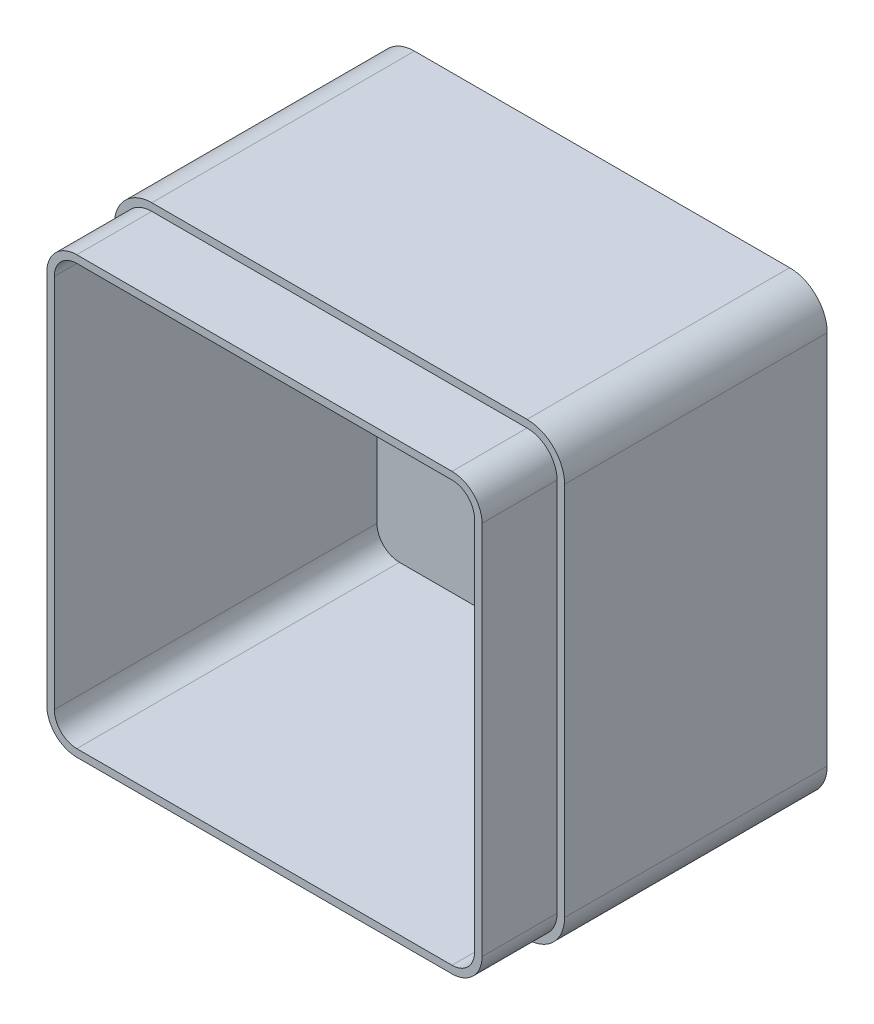
from build123d import *

# Parameters (mm, degrees)
SKETCH1_W           = 120
SKETCH1_H           = 120
BOSS_EXTRUDE1_DEPTH = 90
FILLET1_R           = 10
SHELL1_T            = -4
CUT_EXTRUDE1_DEPTH  = 20


with BuildPart() as part:
    # Sketch1 → Boss-Extrude1 (new body)
    with BuildSketch(Plane.XY):
        Rectangle(SKETCH1_W, SKETCH1_H)
    extrude(amount=BOSS_EXTRUDE1_DEPTH)

    # Fillet1
    fillet1_edges = [part.edges().sort_by_distance(p)[0] for p in [
        (60, -60, 45),
        (-60, -60, 45),
        (-60, 60, 45),
        (60, 60, 45),
    ]]
    fillet(fillet1_edges, radius=FILLET1_R)

    # Shell1
    shell1_openings = [part.faces().sort_by_distance(p)[0] for p in [
        (0, 0, 90),
    ]]
    offset(amount=SHELL1_T, openings=shell1_openings, kind=Kind.INTERSECTION)

    # Sketch2 → Cut-Extrude1 (cut)
    with BuildSketch(Plane.XY.offset(90)):
        with BuildLine():
            ThreePointArc((60, 50), (57.071067812, 57.071067812), (50, 60))
            Line((50, 60), (-50, 60))
            ThreePointArc((-50, 60), (-57.071067812, 57.071067812), (-60, 50))
            Line((-60, 50), (-60, -50))
            ThreePointArc((-60, -50), (-57.071067812, -57.071067812), (-50, -60))
            Line((-50, -60), (50, -60))
            ThreePointArc((50, -60), (57.071067812, -57.071067812), (60, -50))
            Line((60, -50), (60, 50))
        make_face()
        with BuildLine():
            ThreePointArc((58, 50), (55.656854249, 55.656854249), (50, 58))
            Line((50, 58), (-50, 58))
            ThreePointArc((-50, 58), (-55.656854249, 55.656854249), (-58, 50))
            Line((-58, 50), (-58, -50))
            ThreePointArc((-58, -50), (-55.656854249, -55.656854249), (-50, -58))
            Line((-50, -58), (50, -58))
            ThreePointArc((50, -58), (55.656854249, -55.656854249), (58, -50))
            Line((58, -50), (58, 50))
        make_face(mode=Mode.SUBTRACT)
    extrude(amount=-CUT_EXTRUDE1_DEPTH, mode=Mode.SUBTRACT)


solid = part.part
